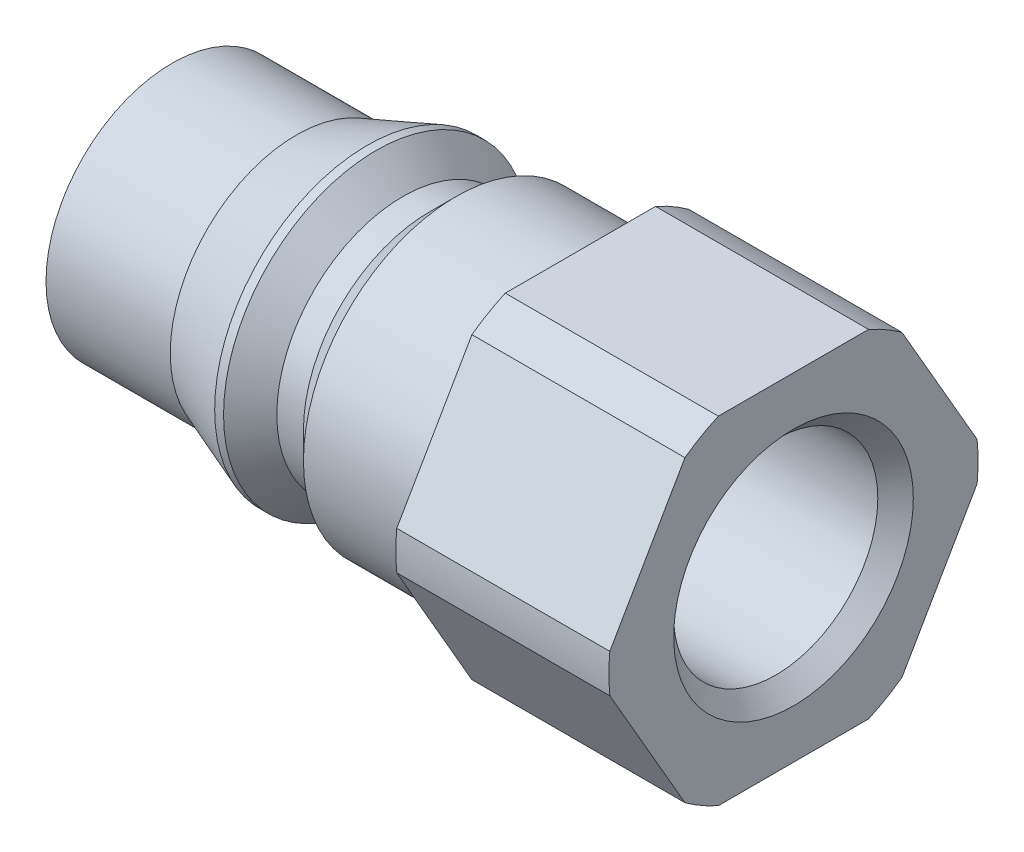
from build123d import *

# Parameters (mm, degrees)
CUT_EXTRUDE1_DEPTH       = 38.964720465
SCHIZZO1_R               = 5.75
TAGLIO_ESTRUSIONE1_DEPTH = 10
SMUSSO1_SIZE             = 1


with BuildPart() as part:
    # Sketch1 → Revolve1 (revolve)
    with BuildSketch(Plane.XY, mode=Mode.PRIVATE) as revolve1_sk:
        Polygon((0, -7.1), (7, -7.1), (11, -8.6), (11.5, -8.6), (13, -7.1), (14.5, -7.1), (16, -8.6), (23, -8.6), (23, -10.4), (35, -10.4), (35, -3.175), (0, -3.175), align=None)
    revolve(revolve1_sk.sketch.rotate(Axis((0, 0, 0), (1, 0, 0)), 270), axis=Axis((0, 0, 0), (1, 0, 0)))

    # Sketch2 → Cut-Extrude1 (cut, through all)
    with BuildSketch(Plane(origin=(35, 0, 0), x_dir=(0, 0, -1), z_dir=(1, 0, 0))):
        with BuildLine():
            Line((-10.343251733, 1.084962483), (-6.111230939, 8.415037517))
            ThreePointArc((-6.111230939, 8.415037517), (-9.006664199, 5.2), (-10.343251733, 1.084962483))
        make_face()
        with BuildLine():
            ThreePointArc((4.232020794, 9.5), (0, 10.4), (-4.232020794, 9.5))
            Line((-4.232020794, 9.5), (4.232020794, 9.5))
        make_face()
        with BuildLine():
            Line((-6.111230939, -8.415037517), (-10.343251733, -1.084962483))
            ThreePointArc((-10.343251733, -1.084962483), (-9.006664199, -5.2), (-6.111230939, -8.415037517))
        make_face()
        with BuildLine():
            ThreePointArc((10.343251733, 1.084962483), (9.006664199, 5.2), (6.111230939, 8.415037517))
            Line((6.111230939, 8.415037517), (10.343251733, 1.084962483))
        make_face()
        with BuildLine():
            Line((4.232020794, -9.5), (-4.232020794, -9.5))
            ThreePointArc((-4.232020794, -9.5), (0, -10.4), (4.232020794, -9.5))
        make_face()
        with BuildLine():
            ThreePointArc((6.111230939, -8.415037517), (9.006664199, -5.2), (10.343251733, -1.084962483))
            Line((10.343251733, -1.084962483), (6.111230939, -8.415037517))
        make_face()
    extrude(amount=-CUT_EXTRUDE1_DEPTH, mode=Mode.SUBTRACT)

    # Schizzo1 → Taglio-Estrusione1 (cut)
    with BuildSketch(Plane(origin=(35, 0, 0), x_dir=(0, 0, -1), z_dir=(1, 0, 0))):
        Circle(SCHIZZO1_R)
    extrude(amount=-TAGLIO_ESTRUSIONE1_DEPTH, mode=Mode.SUBTRACT)

    # Smusso1
    smusso1_edges = [part.edges().sort_by_distance(p)[0] for p in [
        (35, 0, 5.75),
    ]]
    chamfer(smusso1_edges, length=SMUSSO1_SIZE)


solid = part.part
